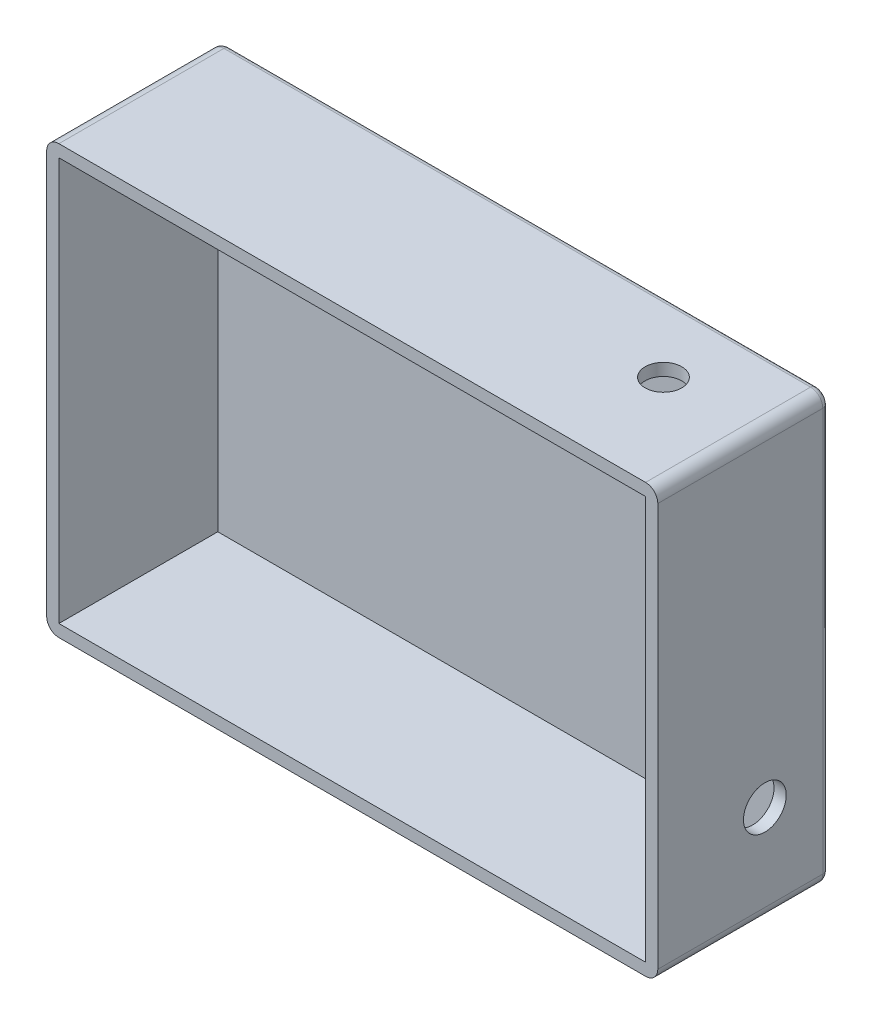
from build123d import *

# Parameters (mm, degrees)
SKETCH1_W           = 500
SKETCH1_H           = 350
BOSS_EXTRUDE2_DEPTH = 140
SKETCH2_R           = 17.5
CUT_EXTRUDE1_DEPTH  = 10
SKETCH3_R           = 15
CUT_EXTRUDE2_DEPTH  = 10
SKETCH4_W           = 480
SKETCH4_H           = 330
CUT_EXTRUDE3_DEPTH  = 130
FILLET1_R           = 10
FILLET3_R           = 5


with BuildPart() as part:
    # Sketch1 → Boss-Extrude2 (new body)
    with BuildSketch(Plane.XY):
        Rectangle(SKETCH1_W, SKETCH1_H)
    extrude(amount=BOSS_EXTRUDE2_DEPTH)

    # Sketch2 → Cut-Extrude1 (cut)
    with BuildSketch(Plane(origin=(250, 0, 0), x_dir=(0, 0, -1), z_dir=(1, 0, 0))):
        with Locations(Location((-52.403317004, -94.104000371, 0), (0, 0, 90))):
            Circle(SKETCH2_R)
    extrude(amount=-CUT_EXTRUDE1_DEPTH, mode=Mode.SUBTRACT)

    # Sketch3 → Cut-Extrude2 (cut)
    with BuildSketch(Plane(origin=(0, 175, 0), x_dir=(1, 0, 0), z_dir=(0, 1, 0))):
        with Locations(Location((172.864228893, -58.246086874, 0), (0, 0, 270))):
            Circle(SKETCH3_R)
    extrude(amount=-CUT_EXTRUDE2_DEPTH, mode=Mode.SUBTRACT)

    # Sketch4 → Cut-Extrude3 (cut)
    with BuildSketch(Plane.XY.offset(140)):
        Rectangle(SKETCH4_W, SKETCH4_H)
    extrude(amount=-CUT_EXTRUDE3_DEPTH, mode=Mode.SUBTRACT)

    # Fillet1
    fillet1_edges = [part.edges().sort_by_distance(p)[0] for p in [
        (250, -175, 70),
        (-250, -175, 70),
        (-250, 175, 70),
        (250, 175, 70),
    ]]
    fillet(fillet1_edges, radius=FILLET1_R)

    # Fillet3
    fillet3_edges = [part.edges().sort_by_distance(p)[0] for p in [
        (0, 175, 0),
        (250, 0, 0),
        (0, -175, 0),
        (-250, 0, 0),
        (-247.071067812, -172.071067812, 0),
        (-247.071067812, 172.071067812, 0),
        (247.071067812, -172.071067812, 0),
        (247.071067812, 172.071067812, 0),
    ]]
    fillet(fillet3_edges, radius=FILLET3_R)


solid = part.part
